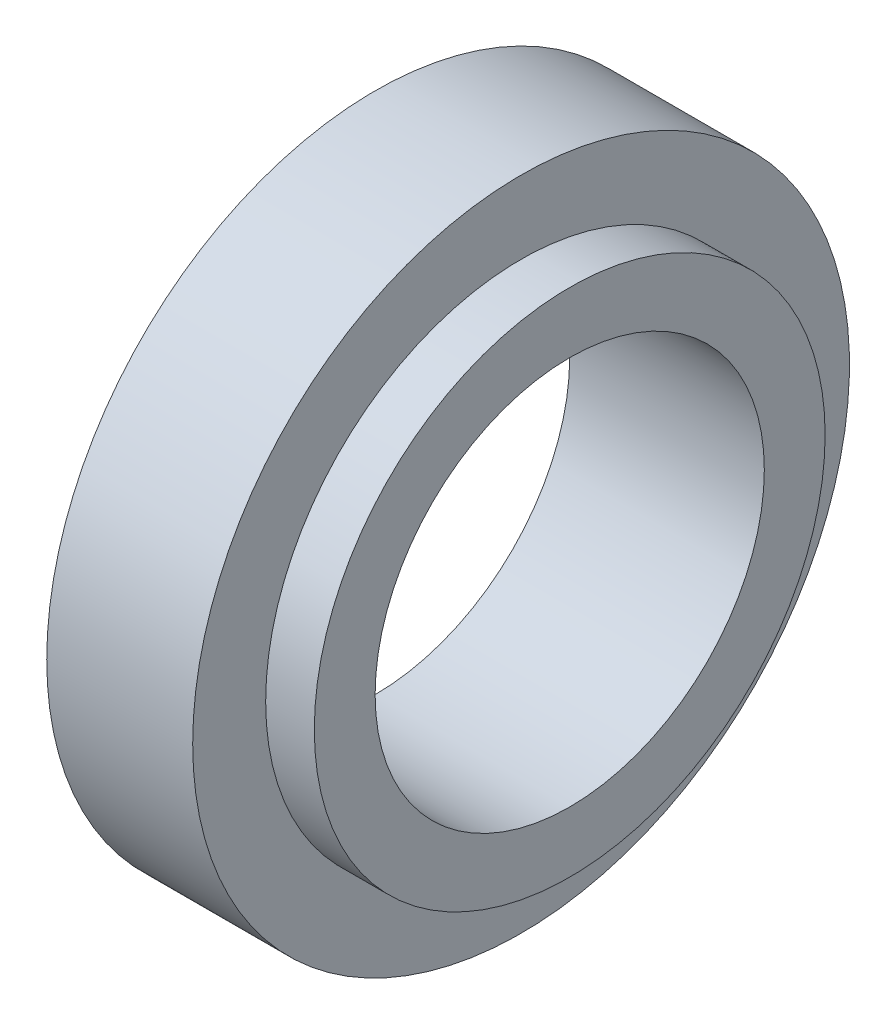
from build123d import *


with BuildPart() as part:
    # 草图1 → 旋转1 (revolve)
    with BuildSketch(Plane.XY, mode=Mode.PRIVATE) as revolve_1_sk:
        Polygon((0, 8), (0, 13.5), (6, 13.5), (6, 10.5), (8, 10.5), (8, 8), align=None)
    revolve(revolve_1_sk.sketch.rotate(Axis((-5.106382979, 0, 0), (1, 0, 0)), 90), axis=Axis((-5.106382979, 0, 0), (1, 0, 0)))


solid = part.part
